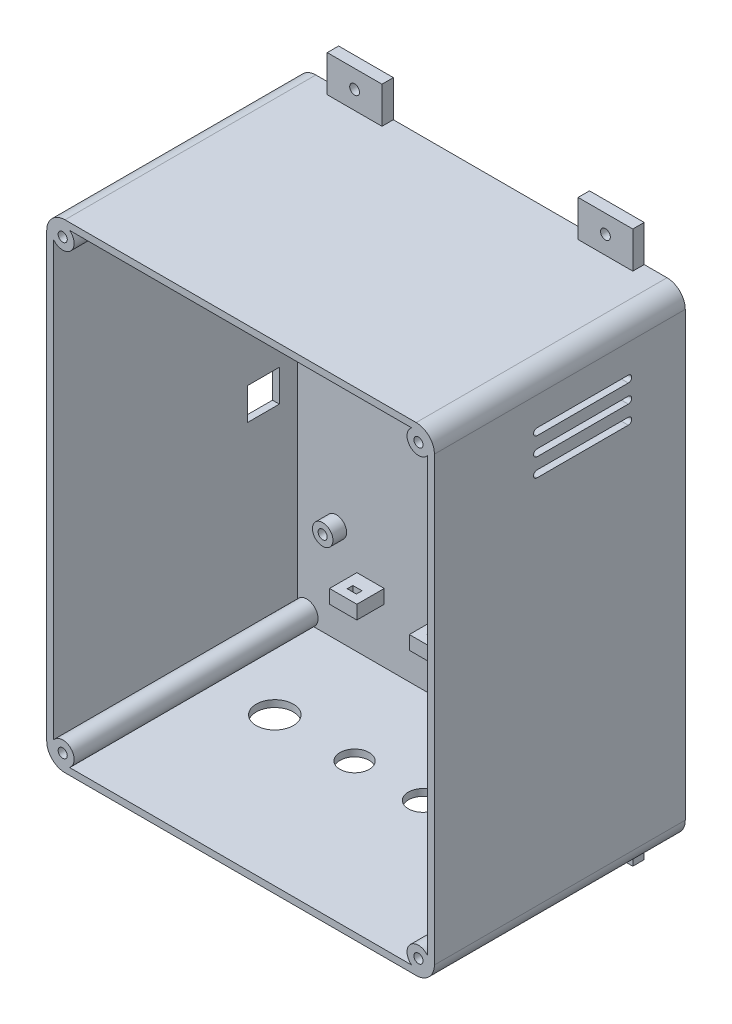
from build123d import *

# Parameters (mm, degrees)
BLOCK_DEPTH                    = 110
SHELL1_T                       = -3
SKETCH2_R                      = 5
CORNER_COLUMNS_DEPTH           = 110
SKETCH3_R                      = 2
FRONT_PANEL_INSERT_HOLES_DEPTH = 7
SKETCH4_R                      = 4.5
PLATE_BOSSES_DEPTH             = 6
SKETCH5_R                      = 2
PLATE_INSERT_HOLES_DEPTH       = 7
SKETCH6_R                      = 8.15
SKETCH6_R_2                    = 6.4
CABLE_GLAND_HOLES_DEPTH        = 4
SKETCH7_W                      = 12
SKETCH7_H                      = 6
CABLE_TIE_BARS_DEPTH           = 12
SKETCH8_W                      = 4
SKETCH8_H                      = 2.5
CABLE_TIE_SLOTS_DEPTH          = 6.02
SKETCH9_W                      = 14
SKETCH9_H                      = 14
USB_ACCESS_DEPTH               = 4
VENTS_LEFT_DEPTH               = 4
VENTS_START                    = -4
VENTS_RIGHT_DEPTH              = 4
SKETCH12_R                     = 4.75
KEYHOLE_HEADS_DEPTH            = 4
KEYHOLE_SLOTS_DEPTH            = 4
SKETCH14_W                     = 24
SKETCH14_H                     = 16
WALL_EARS_DEPTH                = 5
SKETCH15_R                     = 2.15
WALL_EAR_SCREW_HOLES_DEPTH     = 266.331867668


with BuildPart() as part:
    # Sketch1 → Block (new body)
    with BuildSketch(Plane.XY):
        with BuildLine():
            Line((-77, 0), (77, 0))
            ThreePointArc((77, 0), (82.656854249, 2.343145751), (85, 8))
            Line((85, 8), (85, 202))
            ThreePointArc((85, 202), (82.656854249, 207.656854249), (77, 210))
            Line((77, 210), (-77, 210))
            ThreePointArc((-77, 210), (-82.656854249, 207.656854249), (-85, 202))
            Line((-85, 202), (-85, 8))
            ThreePointArc((-85, 8), (-82.656854249, 2.343145751), (-77, 0))
        make_face()
    extrude(amount=BLOCK_DEPTH)

    # Shell1
    shell1_openings = [part.faces().sort_by_distance(p)[0] for p in [
        (0, 105, 110),
    ]]
    offset(amount=SHELL1_T, openings=shell1_openings, kind=Kind.INTERSECTION)

    # Sketch2 → Corner columns (add)
    with BuildSketch(Plane.XY):
        with Locations((-78, 7)):
            Circle(SKETCH2_R)
        with Locations((78, 7)):
            Circle(SKETCH2_R)
        with Locations((-78, 203)):
            Circle(SKETCH2_R)
        with Locations((78, 203)):
            Circle(SKETCH2_R)
    extrude(amount=CORNER_COLUMNS_DEPTH)

    # Sketch3 → Front panel insert holes (cut)
    with BuildSketch(Plane.XY.offset(110)):
        with Locations((-78, 7)):
            Circle(SKETCH3_R)
        with Locations((78, 7)):
            Circle(SKETCH3_R)
        with Locations((-78, 203)):
            Circle(SKETCH3_R)
        with Locations((78, 203)):
            Circle(SKETCH3_R)
    extrude(amount=-FRONT_PANEL_INSERT_HOLES_DEPTH, mode=Mode.SUBTRACT)

    # Sketch4 → Plate bosses (add)
    with BuildSketch(Plane.XY.offset(3)):
        with Locations((-65, 46)):
            Circle(SKETCH4_R)
        with Locations((65, 46)):
            Circle(SKETCH4_R)
        with Locations((-65, 190)):
            Circle(SKETCH4_R)
        with Locations((65, 190)):
            Circle(SKETCH4_R)
    extrude(amount=PLATE_BOSSES_DEPTH)

    # Sketch5 → Plate insert holes (cut)
    with BuildSketch(Plane.XY.offset(9)):
        with Locations((-65, 46)):
            Circle(SKETCH5_R)
        with Locations((65, 46)):
            Circle(SKETCH5_R)
        with Locations((-65, 190)):
            Circle(SKETCH5_R)
        with Locations((65, 190)):
            Circle(SKETCH5_R)
    extrude(amount=-PLATE_INSERT_HOLES_DEPTH, mode=Mode.SUBTRACT)

    # Sketch6 → Cable gland holes (cut)
    with BuildSketch(Plane(origin=(0, 0, 0), x_dir=(1, 0, 0), z_dir=(0, 1, 0))):
        with Locations(Location((-50, -45, 0), (0, 0, 270))):
            Circle(SKETCH6_R)
        with Locations(Location((-15, -45, 0), (0, 0, 270))):
            Circle(SKETCH6_R_2)
        with Locations(Location((15, -45, 0), (0, 0, 270))):
            Circle(SKETCH6_R_2)
        with Locations(Location((50, -45, 0), (0, 0, 270))):
            Circle(SKETCH6_R_2)
    extrude(amount=CABLE_GLAND_HOLES_DEPTH, mode=Mode.SUBTRACT)

    # Sketch7 → Cable tie bars (add)
    with BuildSketch(Plane.XY.offset(3)):
        with Locations((-50, 30)):
            Rectangle(SKETCH7_W, SKETCH7_H)
        with Locations((-15, 30)):
            Rectangle(SKETCH7_W, SKETCH7_H)
        with Locations((15, 30)):
            Rectangle(SKETCH7_W, SKETCH7_H)
        with Locations((50, 30)):
            Rectangle(SKETCH7_W, SKETCH7_H)
    extrude(amount=CABLE_TIE_BARS_DEPTH)

    # Sketch8 → Cable tie slots (cut)
    with BuildSketch(Plane(origin=(0, 26.99, 0), x_dir=(1, 0, 0), z_dir=(0, 1, 0))):
        with Locations((-50, -10)):
            Rectangle(SKETCH8_W, SKETCH8_H)
        with Locations((-15, -10)):
            Rectangle(SKETCH8_W, SKETCH8_H)
        with Locations((15, -10)):
            Rectangle(SKETCH8_W, SKETCH8_H)
        with Locations((50, -10)):
            Rectangle(SKETCH8_W, SKETCH8_H)
    extrude(amount=CABLE_TIE_SLOTS_DEPTH, mode=Mode.SUBTRACT)

    # Sketch9 → USB access (cut)
    with BuildSketch(Plane(origin=(-85, 0, 0), x_dir=(0, 0, -1), z_dir=(1, 0, 0))):
        with Locations((-18, 95)):
            Rectangle(SKETCH9_W, SKETCH9_H)
    extrude(amount=USB_ACCESS_DEPTH, mode=Mode.SUBTRACT)

    # Sketch10 → Vents left (cut)
    with BuildSketch(Plane(origin=(-85, 0, 0), x_dir=(0, 0, -1), z_dir=(1, 0, 0))):
        with BuildLine():
            Line((-25, 170.5), (-65, 170.5))
            ThreePointArc((-65, 170.5), (-66.5, 172), (-65, 173.5))
            Line((-65, 173.5), (-25, 173.5))
            ThreePointArc((-25, 173.5), (-23.5, 172), (-25, 170.5))
        make_face()
        with BuildLine():
            Line((-25, 178.5), (-65, 178.5))
            ThreePointArc((-65, 178.5), (-66.5, 180), (-65, 181.5))
            Line((-65, 181.5), (-25, 181.5))
            ThreePointArc((-25, 181.5), (-23.5, 180), (-25, 178.5))
        make_face()
        with BuildLine():
            Line((-25, 186.5), (-65, 186.5))
            ThreePointArc((-65, 186.5), (-66.5, 188), (-65, 189.5))
            Line((-65, 189.5), (-25, 189.5))
            ThreePointArc((-25, 189.5), (-23.5, 188), (-25, 186.5))
        make_face()
    extrude(amount=VENTS_LEFT_DEPTH, mode=Mode.SUBTRACT)

    # Sketch11 → Vents right (cut)
    with BuildSketch(Plane(origin=(85, 0, 0), x_dir=(0, 0, -1), z_dir=(1, 0, 0)).offset(VENTS_START)):
        with BuildLine():
            Line((-25, 170.5), (-65, 170.5))
            ThreePointArc((-65, 170.5), (-66.5, 172), (-65, 173.5))
            Line((-65, 173.5), (-25, 173.5))
            ThreePointArc((-25, 173.5), (-23.5, 172), (-25, 170.5))
        make_face()
        with BuildLine():
            Line((-25, 178.5), (-65, 178.5))
            ThreePointArc((-65, 178.5), (-66.5, 180), (-65, 181.5))
            Line((-65, 181.5), (-25, 181.5))
            ThreePointArc((-25, 181.5), (-23.5, 180), (-25, 178.5))
        make_face()
        with BuildLine():
            Line((-25, 186.5), (-65, 186.5))
            ThreePointArc((-65, 186.5), (-66.5, 188), (-65, 189.5))
            Line((-65, 189.5), (-25, 189.5))
            ThreePointArc((-25, 189.5), (-23.5, 188), (-25, 186.5))
        make_face()
    extrude(amount=VENTS_RIGHT_DEPTH, mode=Mode.SUBTRACT)

    # Sketch12 → Keyhole heads (cut)
    with BuildSketch(Plane.XY):
        with Locations((-45, 165)):
            Circle(SKETCH12_R)
        with Locations((45, 165)):
            Circle(SKETCH12_R)
    extrude(amount=KEYHOLE_HEADS_DEPTH, mode=Mode.SUBTRACT)

    # Sketch13 → Keyhole slots (cut)
    with BuildSketch(Plane.XY):
        with BuildLine():
            Line((-47.15, 165), (-47.15, 176))
            ThreePointArc((-47.15, 176), (-45, 178.15), (-42.85, 176))
            Line((-42.85, 176), (-42.85, 165))
            ThreePointArc((-42.85, 165), (-45, 162.85), (-47.15, 165))
        make_face()
        with BuildLine():
            Line((42.85, 165), (42.85, 176))
            ThreePointArc((42.85, 176), (45, 178.15), (47.15, 176))
            Line((47.15, 176), (47.15, 165))
            ThreePointArc((47.15, 165), (45, 162.85), (42.85, 165))
        make_face()
    extrude(amount=KEYHOLE_SLOTS_DEPTH, mode=Mode.SUBTRACT)

    # Sketch14 → Wall ears (add)
    with BuildSketch(Plane.XY):
        with Locations((-55, -8)):
            Rectangle(SKETCH14_W, SKETCH14_H)
        with Locations((-55, 218)):
            Rectangle(SKETCH14_W, SKETCH14_H)
        with Locations((55, -8)):
            Rectangle(SKETCH14_W, SKETCH14_H)
        with Locations((55, 218)):
            Rectangle(SKETCH14_W, SKETCH14_H)
    extrude(amount=WALL_EARS_DEPTH)

    # Sketch15 → Wall ear screw holes (cut, through all)
    with BuildSketch(Plane.XY):
        with Locations(Location((-55, -8, 0), (0, 0, 180))):
            Circle(SKETCH15_R)
        with Locations(Location((-55, 218, 0), (0, 0, 180))):
            Circle(SKETCH15_R)
        with Locations(Location((55, -8, 0), (0, 0, 180))):
            Circle(SKETCH15_R)
        with Locations(Location((55, 218, 0), (0, 0, 180))):
            Circle(SKETCH15_R)
    extrude(amount=WALL_EAR_SCREW_HOLES_DEPTH, mode=Mode.SUBTRACT)


solid = part.part
